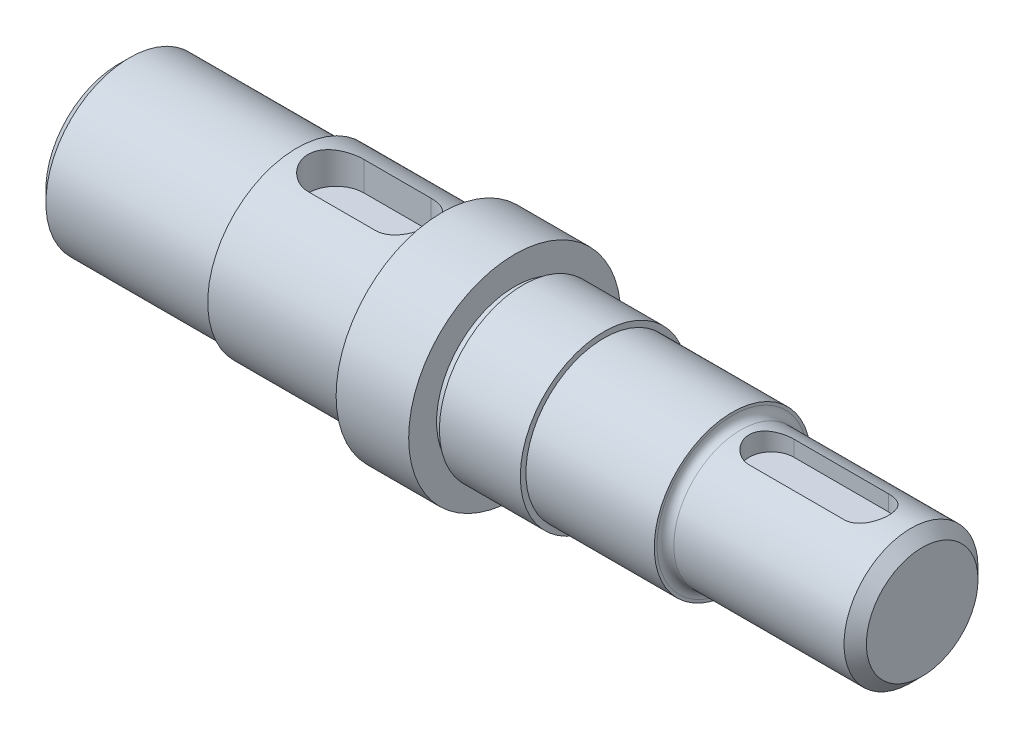
from build123d import *

# Parameters (mm, degrees)
SKETCH_1_R          = 15
EXTRUDE_1_DEPTH     = 32
CHAMFER_1_SIZE      = 2
SKETCH_2_R          = 16
EXTRUDE_2_DEPTH     = 26
SKETCH_3_R          = 19
EXTRUDE_3_DEPTH     = 13
SKETCH_4_R          = 14
EXTRUDE_4_DEPTH     = 1.5
SKETCH_5_R          = 15
EXTRUDE_5_DEPTH     = 14.5
SKETCH_6_R          = 14
EXTRUDE_6_DEPTH     = 23
SKETCH_7_R          = 12
EXTRUDE_7_DEPTH     = 34
FILLET_1_R          = 1.5
CHAMFER_2_SIZE      = 2
CUT_EXTRUDE_START   = 16
CUT_EXTRUDE_1_DEPTH = 6
CUT_EXTRUDE_START_2 = 12
CUT_EXTRUDE_2_DEPTH = 3.5


with BuildPart() as part:
    # 草图1 → 凸台-拉伸1 (new body)
    with BuildSketch(Plane(origin=(0, 0, 0), x_dir=(0, 0, -1), z_dir=(1, 0, 0))):
        Circle(SKETCH_1_R)
    extrude(amount=EXTRUDE_1_DEPTH)

    # 倒角1
    chamfer_1_edges = [part.edges().sort_by_distance(p)[0] for p in [
        (0, 0, 15),
    ]]
    chamfer(chamfer_1_edges, length=CHAMFER_1_SIZE)

    # 草图2 → 凸台-拉伸2 (add)
    with BuildSketch(Plane(origin=(32, 0, 0), x_dir=(0, 0, -1), z_dir=(1, 0, 0))):
        Circle(SKETCH_2_R)
    extrude(amount=EXTRUDE_2_DEPTH)

    # 草图3 → 凸台-拉伸3 (add)
    with BuildSketch(Plane(origin=(58, 0, 0), x_dir=(0, 0, -1), z_dir=(1, 0, 0))):
        Circle(SKETCH_3_R)
    extrude(amount=EXTRUDE_3_DEPTH)

    # 草图4 → 凸台-拉伸4 (add)
    with BuildSketch(Plane(origin=(71, 0, 0), x_dir=(0, 0, -1), z_dir=(1, 0, 0))):
        Circle(SKETCH_4_R)
    extrude(amount=EXTRUDE_4_DEPTH)

    # 草图5 → 凸台-拉伸5 (add)
    with BuildSketch(Plane(origin=(72.5, 0, 0), x_dir=(0, 0, -1), z_dir=(1, 0, 0))):
        Circle(SKETCH_5_R)
    extrude(amount=EXTRUDE_5_DEPTH)

    # 草图6 → 凸台-拉伸6 (add)
    with BuildSketch(Plane(origin=(87, 0, 0), x_dir=(0, 0, -1), z_dir=(1, 0, 0))):
        Circle(SKETCH_6_R)
    extrude(amount=EXTRUDE_6_DEPTH)

    # 草图7 → 凸台-拉伸7 (add)
    with BuildSketch(Plane(origin=(110, 0, 0), x_dir=(0, 0, -1), z_dir=(1, 0, 0))):
        Circle(SKETCH_7_R)
    extrude(amount=EXTRUDE_7_DEPTH)

    # 圆角1
    fillet_1_edges = [part.edges().sort_by_distance(p)[0] for p in [
        (110, 0, 12),
    ]]
    fillet(fillet_1_edges, radius=FILLET_1_R)

    # 倒角2
    chamfer_2_edges = [part.edges().sort_by_distance(p)[0] for p in [
        (144, 0, 12),
    ]]
    chamfer(chamfer_2_edges, length=CHAMFER_2_SIZE)

    # 草图8 → 切除-拉伸1 (cut)
    with BuildSketch(Plane(origin=(0, 0, 0), x_dir=(1, 0, 0), z_dir=(0, 1, 0)).offset(CUT_EXTRUDE_START)):
        with BuildLine():
            Line((39, 5), (51, 5))
            ThreePointArc((51, 5), (56, 0), (51, -5))
            Line((51, -5), (39, -5))
            ThreePointArc((39, -5), (34, 0), (39, 5))
        make_face()
    extrude(amount=-CUT_EXTRUDE_1_DEPTH, mode=Mode.SUBTRACT)

    # 草图9 → 切除-拉伸2 (cut)
    with BuildSketch(Plane(origin=(0, 0, 0), x_dir=(1, 0, 0), z_dir=(0, 1, 0)).offset(CUT_EXTRUDE_START_2)):
        with BuildLine():
            Line((117, 4), (134, 4))
            ThreePointArc((134, 4), (138, 0), (134, -4))
            Line((134, -4), (117, -4))
            ThreePointArc((117, -4), (113, 0), (117, 4))
        make_face()
    extrude(amount=-CUT_EXTRUDE_2_DEPTH, mode=Mode.SUBTRACT)


solid = part.part
